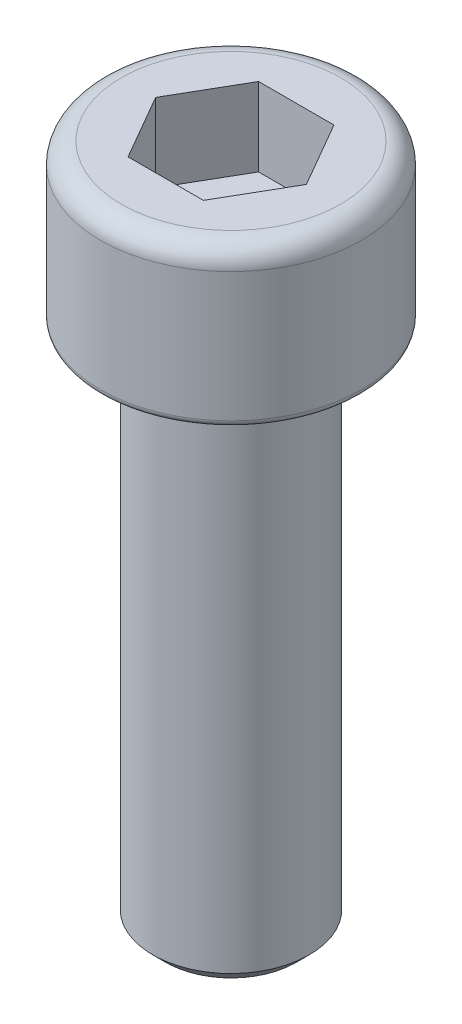
from build123d import *

# Parameters (mm, degrees)
CUT_EXTRUDE1_DEPTH = 3
FILLET3_R          = 0.8
CHAMFER1_SIZE      = 0.5
FILLET4_R          = 0.25


with BuildPart() as part:
    # Sketch1 → Revolve1 (revolve)
    with BuildSketch(Plane.XY, mode=Mode.PRIVATE) as revolve1_sk:
        Polygon((0, 0), (5, 0), (5, -6), (3, -6), (3, -26), (0, -26), align=None)
    revolve(revolve1_sk.sketch.rotate(Axis((0, -31, 0), (0, 1, 0)), 90), axis=Axis((0, -31, 0), (0, 1, 0)))

    # Sketch2 → Cut-Extrude1 (cut)
    with BuildSketch(Plane(origin=(0, 0, 0), x_dir=(1, 0, 0), z_dir=(0, 1, 0))):
        Polygon((2.886751346, 0), (1.443375673, 2.5), (-1.443375673, 2.5), (-2.886751346, 0), (-1.443375673, -2.5), (1.443375673, -2.5), align=None)
    extrude(amount=-CUT_EXTRUDE1_DEPTH, mode=Mode.SUBTRACT)

    # Fillet3
    fillet3_edges = [part.edges().sort_by_distance(p)[0] for p in [
        (0, 0, 5),
    ]]
    fillet(fillet3_edges, radius=FILLET3_R)

    # Chamfer1
    chamfer1_edges = [part.edges().sort_by_distance(p)[0] for p in [
        (0, -26, 3),
    ]]
    chamfer(chamfer1_edges, length=CHAMFER1_SIZE)

    # Fillet4
    fillet4_edges = [part.edges().sort_by_distance(p)[0] for p in [
        (0, -6, 3),
        (0, -6, 5),
    ]]
    fillet(fillet4_edges, radius=FILLET4_R)


solid = part.part
